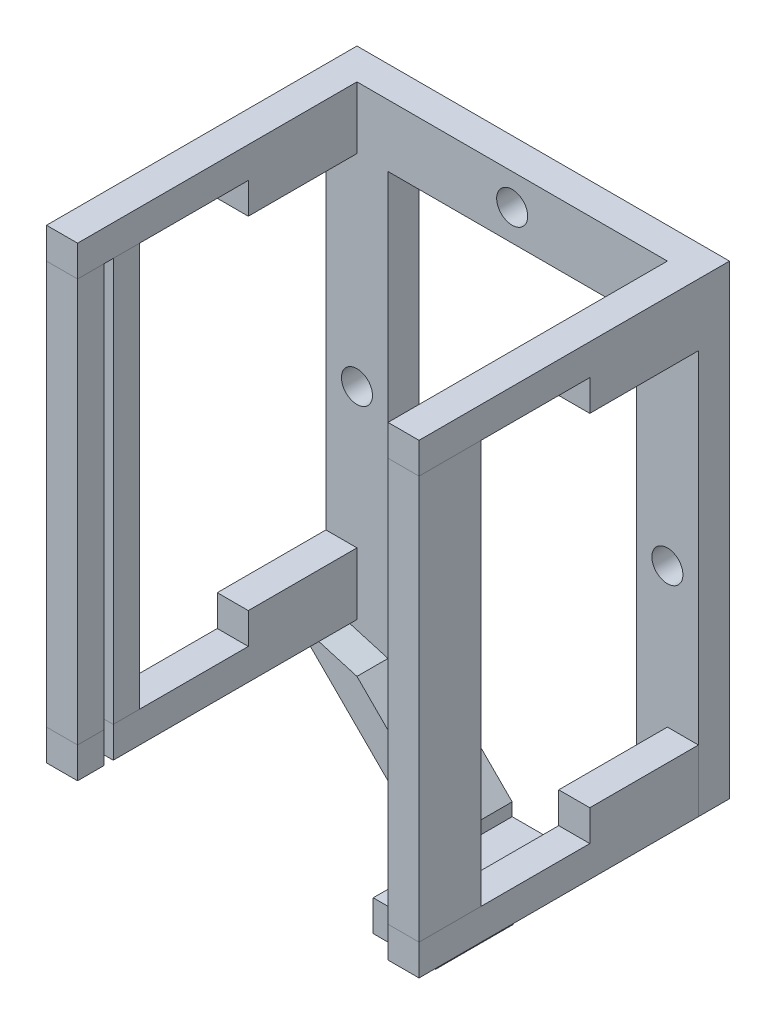
from build123d import *

# Parameters (mm, degrees)
EXTRUSION2_DEPTH             = 20
ESQUISSE3_W                  = 89.728049728
ESQUISSE3_H                  = 20
ENL_V_MAT_EXTRU_1_DEPTH      = 10
ENL_V_MAT_EXTRU_3_DEPTH      = 50.727536527
ESQUISSE6_W                  = 10
ESQUISSE6_H                  = 20
EXTRUSION3_DEPTH             = 90
ESQUISSE7_W                  = 10
ESQUISSE7_H                  = 10
ENL_V_MAT_EXTRU_4_DEPTH      = 55
ESQUISSE8_W                  = 10
ESQUISSE8_H                  = 20
EXTRUSION7_DEPTH             = 90
EXTRUSION7_2_DEPTH           = 90
ESQUISSE9_W                  = 55
ESQUISSE9_H                  = 10
ENL_V_MAT_EXTRU_5_DEPTH      = 142.141603978
ESQUISSE10_W                 = 20
ESQUISSE10_H                 = 10
EXTRUSION8_DEPTH             = 25
ESQUISSE11_W                 = 20
ESQUISSE11_H                 = 130
EXTRUSION10_DEPTH            = 10
ESQUISSE12_W                 = 20
ESQUISSE12_H                 = 130
EXTRUSION12_DEPTH            = 10
ENL_V_MAT_EXTRU_6_DEPTH      = 105
ENL_V_MAT_EXTRU_6_DEPTH_BACK = 5
ESQUISSE13_W                 = 3
ESQUISSE13_H                 = 140
ENL_V_MAT_EXTRU_7_DEPTH      = 105
ENL_V_MAT_EXTRU_7_DEPTH_BACK = 5
ESQUISSE14_W                 = 3
ESQUISSE14_H                 = 11.069986055
ESQUISSE15_R                 = 5
ENL_V_MAT_EXTRU_8_DEPTH      = 28.101955853
ESQUISSE16_W                 = 20.242323371
ESQUISSE16_H                 = 4.142135624
ENL_V_MAT_EXTRU_9_DEPTH      = 28.101955853


with BuildPart() as part:
    # Esquisse2 → Extrusion2 (new body)
    with BuildSketch(Plane.XY):
        Polygon((-70, 50), (-20, 0), (0, 0), (50, 50), (50, 200), (-70, 200), align=None)
        Polygon((-50, 180), (30, 180), (30, 44.142135624), (0, 14.142135624), (-20, 14.142135624), (-50, 44.142135624), align=None, mode=Mode.SUBTRACT)
    extrude(amount=EXTRUSION2_DEPTH)

    # Esquisse3 → Enlèv. mat.-Extru.1 (cut)
    with BuildSketch(Plane.XY.offset(20)):
        with Locations((-5.135975136, 190)):
            Rectangle(ESQUISSE3_W, ESQUISSE3_H)
    extrude(amount=-ENL_V_MAT_EXTRU_1_DEPTH, mode=Mode.SUBTRACT)

    # Esquisse5 → Enlèv. mat.-Extru.3 (cut)
    with BuildSketch(Plane.XY.offset(10)):
        Polygon((-70, 50), (-50, 44.142135624), (30, 44.142135624), (50, 50), (50, 200), (-70, 200), align=None)
    extrude(amount=ENL_V_MAT_EXTRU_3_DEPTH, mode=Mode.SUBTRACT)

    # Esquisse6 → Extrusion3 (add)
    with BuildSketch(Plane.XY.offset(10)):
        with Locations((-65, 190)):
            Rectangle(ESQUISSE6_W, ESQUISSE6_H)
        with Locations((45, 190)):
            Rectangle(ESQUISSE6_W, ESQUISSE6_H)
    extrude(amount=EXTRUSION3_DEPTH)

    # Esquisse7 → Enlèv. mat.-Extru.4 (cut)
    with BuildSketch(Plane.XY.offset(100)):
        with Locations((-65, 185)):
            Rectangle(ESQUISSE7_W, ESQUISSE7_H)
        with Locations((45, 185)):
            Rectangle(ESQUISSE7_W, ESQUISSE7_H)
    extrude(amount=-ENL_V_MAT_EXTRU_4_DEPTH, mode=Mode.SUBTRACT)

    # Esquisse10 → Extrusion8 (add)
    with BuildSketch(Plane.XY.offset(20)):
        with Locations((-9.757676629, 5)):
            Rectangle(ESQUISSE10_W, ESQUISSE10_H)
    extrude(amount=EXTRUSION8_DEPTH)

    # Esquisse15 → Enlèv. mat.-Extru.8 (cut)
    with BuildSketch(Plane(origin=(0, 0, 0), x_dir=(-1, 0, 0), z_dir=(0, 0, -1))):
        with Locations((10, 190)):
            Circle(ESQUISSE15_R)
        with Locations((-40, 115)):
            Circle(ESQUISSE15_R)
        with Locations((60, 115)):
            Circle(ESQUISSE15_R)
    extrude(amount=-ENL_V_MAT_EXTRU_8_DEPTH, mode=Mode.SUBTRACT)

    # Esquisse16 → Enlèv. mat.-Extru.9 (cut)
    with BuildSketch(Plane.XY.offset(20)):
        with Locations((-9.878838314, 12.071067812)):
            Rectangle(ESQUISSE16_W, ESQUISSE16_H)
    extrude(amount=-ENL_V_MAT_EXTRU_9_DEPTH, mode=Mode.SUBTRACT)


with BuildPart() as body_2:
    # Esquisse8 → Extrusion7 (new body)
    with BuildSketch(Plane.XY.offset(10)):
        with Locations((-65, 60)):
            Rectangle(ESQUISSE8_W, ESQUISSE8_H)
    extrude(amount=EXTRUSION7_DEPTH)


with BuildPart() as body_3:
    # Esquisse8 → Extrusion7 2 (new body)
    with BuildSketch(Plane.XY.offset(10)):
        with Locations((45, 60)):
            Rectangle(ESQUISSE8_W, ESQUISSE8_H)
    extrude(amount=EXTRUSION7_2_DEPTH)


with BuildPart() as enl_v_mat_extru_5_tool:
    # Esquisse9 → Enlèv. mat.-Extru.5 (new body)
    with BuildSketch(Plane.ZY.offset(70)):
        with Locations((72.5, 65)):
            Rectangle(ESQUISSE9_W, ESQUISSE9_H)
    extrude(amount=-ENL_V_MAT_EXTRU_5_DEPTH)


with BuildPart() as body_2_1:
    add(body_2.part)

    # Enlèv. mat.-Extru.5: cut by enl_v_mat_extru_5_tool
    add(enl_v_mat_extru_5_tool.part, mode=Mode.SUBTRACT)


with BuildPart() as body_3_1:
    add(body_3.part)

    # Enlèv. mat.-Extru.5: cut by enl_v_mat_extru_5_tool
    add(enl_v_mat_extru_5_tool.part, mode=Mode.SUBTRACT)


with BuildPart() as body_4:
    # Esquisse11 → Extrusion10 (new body)
    with BuildSketch(Plane(origin=(50, 0, 0), x_dir=(0, 0, -1), z_dir=(1, 0, 0))):
        with Locations((-90, 125)):
            Rectangle(ESQUISSE11_W, ESQUISSE11_H)
    extrude(amount=-EXTRUSION10_DEPTH)


with BuildPart() as body_5:
    # Esquisse12 → Extrusion12 (new body)
    with BuildSketch(Plane.ZY.offset(70)):
        with Locations((90, 125)):
            Rectangle(ESQUISSE12_W, ESQUISSE12_H)
    extrude(amount=-EXTRUSION12_DEPTH)


with BuildPart() as enl_v_mat_extru_6_tool:
    # Esquisse13 → Enlèv. mat.-Extru.6 (new, two sides: drawn at the far end of the back side and taken through both)
    with BuildSketch(Plane.ZY.offset(-40).offset(-ENL_V_MAT_EXTRU_6_DEPTH_BACK)):
        with Locations((90, 120)):
            Rectangle(ESQUISSE13_W, ESQUISSE13_H)
    extrude(amount=ENL_V_MAT_EXTRU_6_DEPTH + ENL_V_MAT_EXTRU_6_DEPTH_BACK)


with BuildPart() as body_4_1:
    add(body_4.part)

    # Enlèv. mat.-Extru.6: cut by enl_v_mat_extru_6_tool
    add(enl_v_mat_extru_6_tool.part, mode=Mode.SUBTRACT)


with BuildPart() as body_5_1:
    add(body_5.part)

    # Enlèv. mat.-Extru.6: cut by enl_v_mat_extru_6_tool
    add(enl_v_mat_extru_6_tool.part, mode=Mode.SUBTRACT)


with BuildPart() as enl_v_mat_extru_7_tool:
    # Esquisse14 → Enlèv. mat.-Extru.7 (new, two sides: drawn at the far end of the back side and taken through both)
    with BuildSketch(Plane.ZY.offset(-40).offset(-ENL_V_MAT_EXTRU_7_DEPTH_BACK)):
        with Locations((90, 55.534993028)):
            Rectangle(ESQUISSE14_W, ESQUISSE14_H)
    extrude(amount=ENL_V_MAT_EXTRU_7_DEPTH + ENL_V_MAT_EXTRU_7_DEPTH_BACK)


with BuildPart() as body_2_2:
    add(body_2_1.part)

    # Enlèv. mat.-Extru.7: cut by enl_v_mat_extru_7_tool
    add(enl_v_mat_extru_7_tool.part, mode=Mode.SUBTRACT)


with BuildPart() as body_3_2:
    add(body_3_1.part)

    # Enlèv. mat.-Extru.7: cut by enl_v_mat_extru_7_tool
    add(enl_v_mat_extru_7_tool.part, mode=Mode.SUBTRACT)


solid = Compound([part.part, body_4_1.part, body_5_1.part, body_2_2.part, body_3_2.part])
